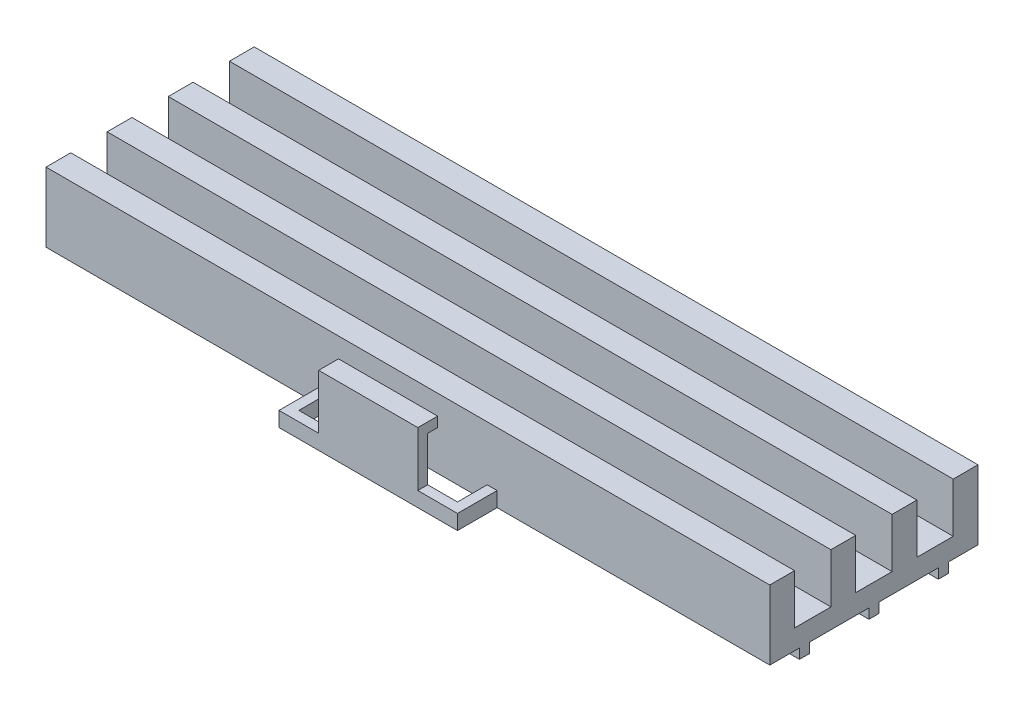
from build123d import *

# Parameters (mm, degrees)
BOSS_EXTRUDE1_DEPTH = 36.5
EXTRUDE_THIN1_DEPTH = 1.5
EXTRUDE_THIN2_DEPTH = 5


with BuildPart() as part:
    # Sketch1 → Boss-Extrude1 (new, symmetric)
    with BuildSketch(Plane(origin=(0, 0, 0), x_dir=(0, 0, -1), z_dir=(1, 0, 0))):
        Polygon((0.5, 0), (-0.5, 0), (-0.5, 1), (-6.5, 1), (-6.5, 0), (-7.5, 0), (-7.5, 1), (-10.5, 1), (-10.5, 8), (-8, 8), (-8, 3), (-4.333333333, 3), (-4.333333333, 8), (-1.833333333, 8), (-1.833333333, 3), (1.833333333, 3), (1.833333333, 8), (4.333333333, 8), (4.333333333, 3), (8, 3), (8, 8), (10.5, 8), (10.5, 1), (7.5, 1), (7.5, 0), (6.5, 0), (6.5, 1), (0.5, 1), align=None)
    extrude(amount=BOSS_EXTRUDE1_DEPTH, both=True)

    # Sketch3 → Extrude-Thin1 (add)
    with BuildSketch(Plane(origin=(0, 1, 0), x_dir=(1, 0, 0), z_dir=(0, 1, 0))):
        Polygon((-9, -10.5), (-9, -14.5), (9, -14.5), (9, -10.5), (8, -10.5), (8, -13.5), (-8, -13.5), (-8, -10.5), align=None)
    extrude(amount=EXTRUDE_THIN1_DEPTH)

    # Sketch4 → Extrude-Thin2 (add, symmetric)
    with BuildSketch(Plane(origin=(0, 0, 0), x_dir=(0, 0, -1), z_dir=(1, 0, 0))):
        Polygon((-14.5, 2.5), (-14.5, 8), (-12.5, 8), (-12.5, 7), (-13.5, 7), (-13.5, 2.5), align=None)
    extrude(amount=EXTRUDE_THIN2_DEPTH, both=True)


solid = part.part
